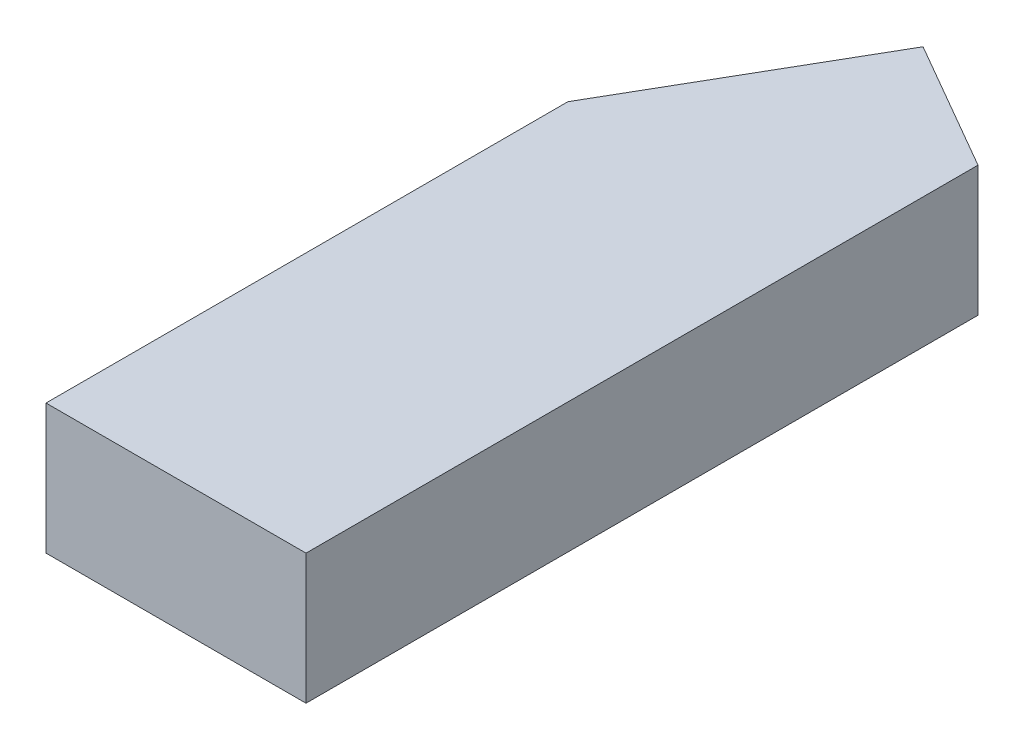
from build123d import *

# Parameters (mm, degrees)
BOSS_EXTRUDE1_DEPTH = 10


with BuildPart() as part:
    # Sketch1 → Boss-Extrude1 (new body)
    with BuildSketch(Plane(origin=(0, 0, 0), x_dir=(1, 0, 0), z_dir=(0, 1, 0))):
        Polygon((59.961524227, -17.07179677), (39.961524227, -17.07179677), (39.961524227, 23.07179677), (49.961524227, 40.392304845), (59.961524227, 34.618802154), align=None)
    extrude(amount=BOSS_EXTRUDE1_DEPTH)


solid = part.part
